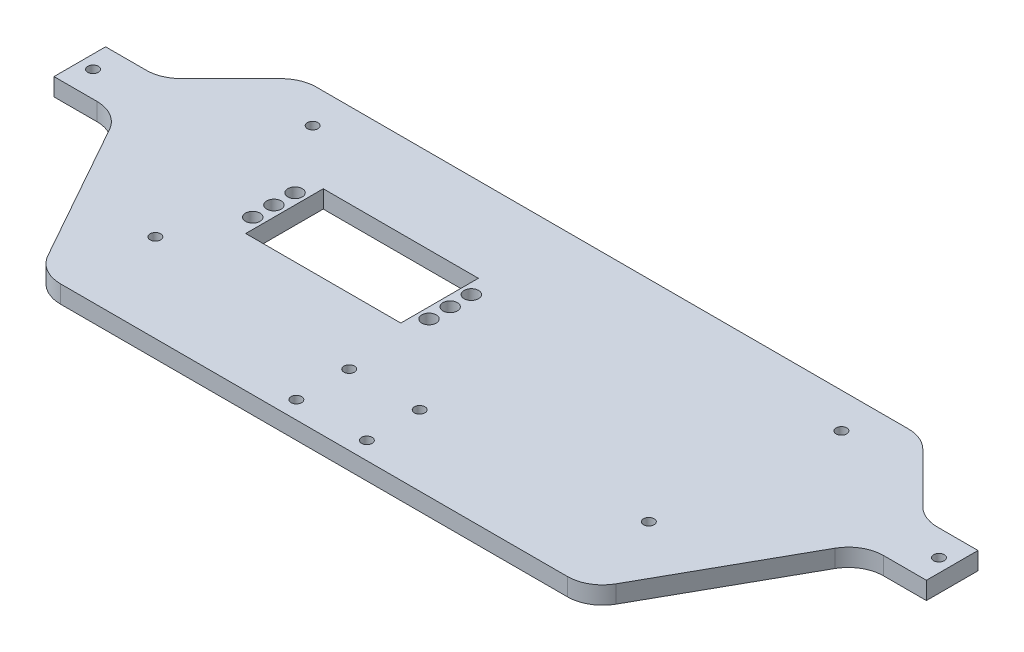
from build123d import *

# Parameters (mm, degrees)
SALIENTE_EXTRUIR1_DEPTH = 5
REDONDEO1_R             = 10
CROQUIS2_R              = 1.5
CROQUIS2_R_2            = 2.05
CROQUIS2_W              = 42
CROQUIS2_H              = 20
CORTAR_EXTRUIR1_DEPTH   = 135.669558943
CROQUIS3_W              = 4
CROQUIS3_H              = 14.636342218
CORTAR_EXTRUIR2_DEPTH   = 135.669558943
CROQUIS4_W              = 44
CROQUIS4_H              = 22
CORTAR_EXTRUIR3_DEPTH   = 131.881206084


with BuildPart() as part:
    # Croquis1 → Saliente-Extruir1 (new body)
    with BuildSketch(Plane(origin=(0, 0, 0), x_dir=(1, 0, 0), z_dir=(0, 1, 0))):
        Polygon((-88.1, 42.318171109), (88.1, 42.318171109), (108.1, 22.318171109), (127.75, 22.318171109), (127.75, 7.681828891), (105.75, 7.681828891), (77.75, -42.318171109), (-77.75, -42.318171109), (-105.75, 7.681828891), (-127.75, 7.681828891), (-127.75, 22.318171109), (-108.1, 22.318171109), align=None)
    extrude(amount=SALIENTE_EXTRUIR1_DEPTH)

    # Redondeo1
    redondeo1_edges = [part.edges().sort_by_distance(p)[0] for p in [
        (-88.1, 2.5, -42.318171109),
        (88.1, 2.5, -42.318171109),
        (108.1, 2.5, -22.318171109),
        (105.75, 2.5, -7.681828891),
        (77.75, 2.5, 42.318171109),
        (-77.75, 2.5, 42.318171109),
        (-105.75, 2.5, -7.681828891),
        (-108.1, 2.5, -22.318171109),
    ]]
    fillet(redondeo1_edges, radius=REDONDEO1_R)

    # Croquis2 → Cortar-Extruir1 (cut, through all)
    with BuildSketch(Plane(origin=(0, 5, 0), x_dir=(1, 0, 0), z_dir=(0, 1, 0))):
        with Locations(Location((70, -17.318171109, 0), (0, 0, 270))):
            Circle(CROQUIS2_R)
        with Locations(Location((-70, -17.318171109, 0), (0, 0, 270))):
            Circle(CROQUIS2_R)
        with Locations(Location((-119.996067812, 15, 0), (0, 0, 270))):
            Circle(CROQUIS2_R)
        with Locations(Location((119.996067812, 15, 0), (0, 0, 270))):
            Circle(CROQUIS2_R)
        with Locations(Location((-75, 32.318171109, 0), (0, 0, 270))):
            Circle(CROQUIS2_R)
        with Locations(Location((75, 32.318171109, 0), (0, 0, 270))):
            Circle(CROQUIS2_R)
        with Locations(Location((-10, -22.318171109, 0), (0, 0, 270))):
            Circle(CROQUIS2_R)
        with Locations(Location((10, -22.318171109, 0), (0, 0, 270))):
            Circle(CROQUIS2_R)
        with Locations(Location((-10, -37.318171109, 0), (0, 0, 270))):
            Circle(CROQUIS2_R)
        with Locations(Location((10, -37.318171109, 0), (0, 0, 270))):
            Circle(CROQUIS2_R)
        with Locations(Location((-61, 7.318171109, 0), (0, 0, 270))):
            Circle(CROQUIS2_R_2)
        with Locations(Location((-11, 7.318171109, 0), (0, 0, 270))):
            Circle(CROQUIS2_R_2)
        with Locations(Location((-61, 13.318171109, 0), (0, 0, 270))):
            Circle(CROQUIS2_R_2)
        with Locations(Location((-61, 1.318171109, 0), (0, 0, 270))):
            Circle(CROQUIS2_R_2)
        with Locations(Location((-11, 13.318171109, 0), (0, 0, 270))):
            Circle(CROQUIS2_R_2)
        with Locations(Location((-11, 1.318171109, 0), (0, 0, 270))):
            Circle(CROQUIS2_R_2)
        with Locations((-36, 7.318171109)):
            Rectangle(CROQUIS2_W, CROQUIS2_H)
    extrude(amount=-CORTAR_EXTRUIR1_DEPTH, mode=Mode.SUBTRACT)

    # Croquis3 → Cortar-Extruir2 (cut, through all)
    with BuildSketch(Plane(origin=(0, 5, 0), x_dir=(1, 0, 0), z_dir=(0, 1, 0))):
        with Locations((-125.75, 15)):
            Rectangle(CROQUIS3_W, CROQUIS3_H)
        with Locations((125.75, 15)):
            Rectangle(CROQUIS3_W, CROQUIS3_H)
    extrude(amount=-CORTAR_EXTRUIR2_DEPTH, mode=Mode.SUBTRACT)

    # Croquis4 → Cortar-Extruir3 (cut, through all)
    with BuildSketch(Plane(origin=(0, 5, 0), x_dir=(1, 0, 0), z_dir=(0, 1, 0))):
        with Locations((-36, 7.318171109)):
            Rectangle(CROQUIS4_W, CROQUIS4_H)
    extrude(amount=-CORTAR_EXTRUIR3_DEPTH, mode=Mode.SUBTRACT)


solid = part.part
